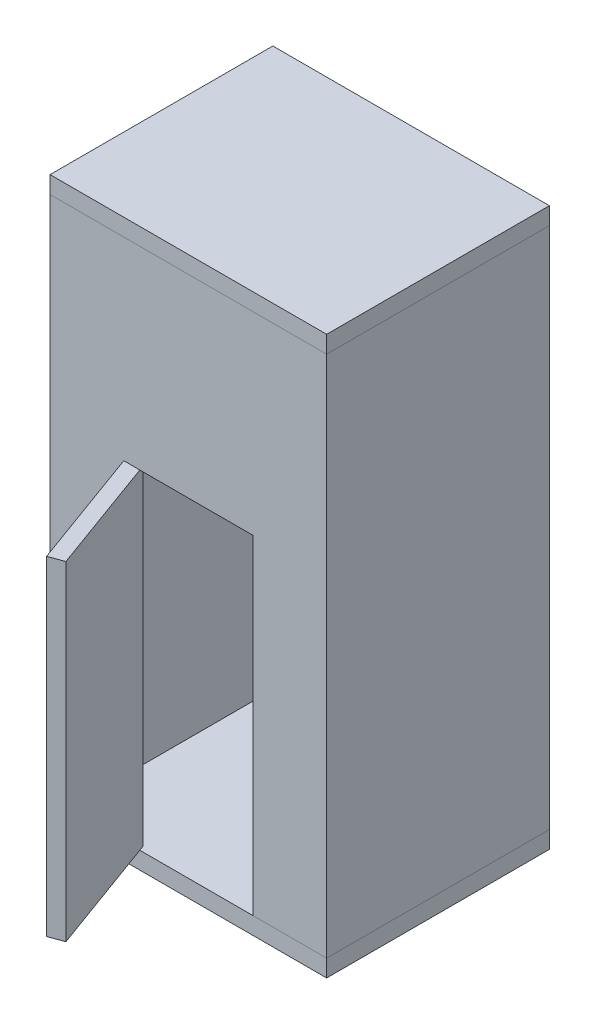
from build123d import *

# Parameters (mm, degrees)
SKETCH1_W           = 1631.95
SKETCH1_H           = 1314.45
SKETCH1_W_2         = 1428.75
SKETCH1_H_2         = 1111.25
BOSS_EXTRUDE1_DEPTH = 3086.1
SKETCH2_W           = 1631.95
SKETCH2_H           = 1314.45
BOSS_EXTRUDE2_DEPTH = 101.6
SKETCH3_W           = 762
SKETCH3_H           = 1943.1
CUT_EXTRUDE1_DEPTH  = 101.6
SKETCH4_W           = 1631.95
SKETCH4_H           = 1314.45
BOSS_EXTRUDE3_DEPTH = 101.6
SKETCH5_W           = 1428.75
SKETCH5_H           = 3086.1
CUT_EXTRUDE2_DEPTH  = 3507.886313117
BOSS_EXTRUDE4_DEPTH = 1943.1


with BuildPart() as part:
    # Sketch1 → Boss-Extrude1 (new body)
    with BuildSketch(Plane(origin=(0, 0, 0), x_dir=(1, 0, 0), z_dir=(0, 1, 0))):
        Rectangle(SKETCH1_W, SKETCH1_H)
        Rectangle(SKETCH1_W_2, SKETCH1_H_2, mode=Mode.SUBTRACT)
    extrude(amount=BOSS_EXTRUDE1_DEPTH)

    # Sketch3 → Cut-Extrude1 (cut)
    with BuildSketch(Plane.XY.offset(657.225)):
        with Locations((0, 971.55)):
            Rectangle(SKETCH3_W, SKETCH3_H)
    extrude(amount=-CUT_EXTRUDE1_DEPTH, mode=Mode.SUBTRACT)

    # Sketch5 → Cut-Extrude2 (cut, through all)
    with BuildSketch(Plane.XY.offset(-555.625)):
        with Locations((0, 1543.05)):
            Rectangle(SKETCH5_W, SKETCH5_H)
    extrude(amount=-CUT_EXTRUDE2_DEPTH, mode=Mode.SUBTRACT)


with BuildPart() as body_2:
    # Sketch2 → Boss-Extrude2 (new body)
    with BuildSketch(Plane(origin=(0, 3086.1, 0), x_dir=(1, 0, 0), z_dir=(0, 1, 0))):
        Rectangle(SKETCH2_W, SKETCH2_H)
    extrude(amount=BOSS_EXTRUDE2_DEPTH)


with BuildPart() as body_3:
    # Sketch4 → Boss-Extrude3 (new body)
    with BuildSketch(Plane.XZ):
        Rectangle(SKETCH4_W, SKETCH4_H)
    extrude(amount=BOSS_EXTRUDE3_DEPTH)


with BuildPart() as body_4:
    # Sketch6 → Boss-Extrude4 (new body)
    with BuildSketch(Plane.XZ.offset(-1943.1)):
        Polygon((-381, 657.225), (-120.380650786, 1373.270777039), (-36.841976798, 1342.865186297), (-297.461326012, 626.819409258), align=None)
    extrude(amount=BOSS_EXTRUDE4_DEPTH)


solid = Compound([part.part, body_2.part, body_3.part, body_4.part])
